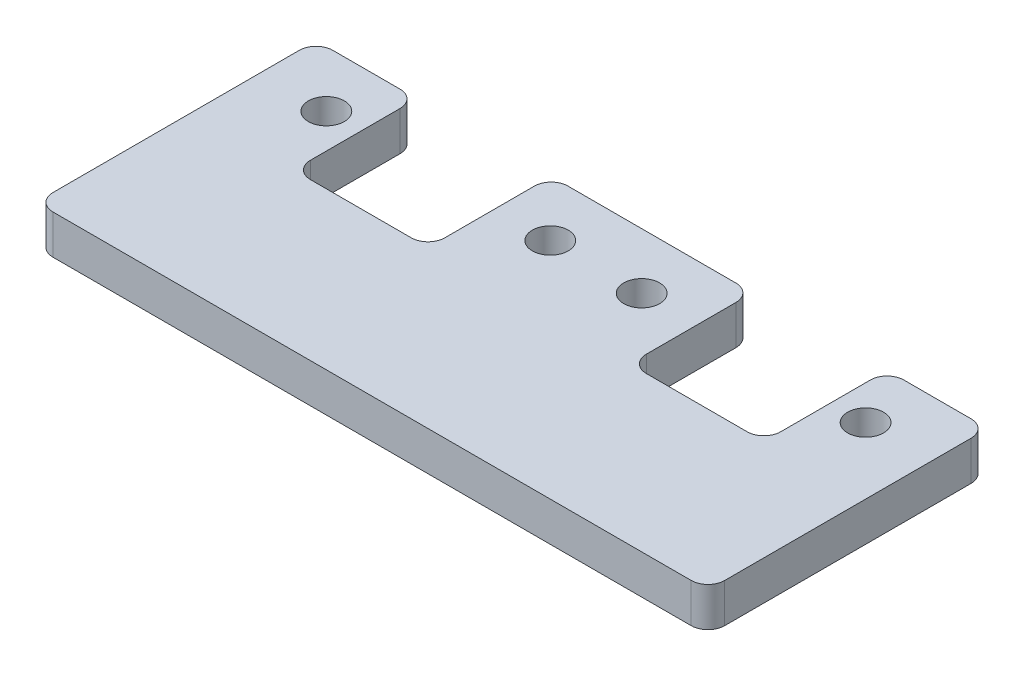
from build123d import *

# Parameters (mm, degrees)
BOSS_EXTRUDE1_DEPTH   = 3.5
F_2_CLEARANCE_HOLE1_D = 3.2131
FILLET1_R             = 1.5


with BuildPart() as part:
    # Sketch1 → Boss-Extrude1 (new body)
    with BuildSketch(Plane(origin=(0, 0, 0), x_dir=(1, 0, 0), z_dir=(0, 1, 0))):
        Polygon((-21, 12.5), (-21, 1.5), (-9, 1.5), (-9, 12.5), (9, 12.5), (9, 1.5), (21, 1.5), (21, 12.5), (30, 12.5), (30, -12.5), (-30, -12.5), (-30, 12.5), align=None)
    extrude(amount=BOSS_EXTRUDE1_DEPTH)

    # #2 Clearance Hole1 (through all)
    with Locations(Plane(origin=(0, 3.5, 0), x_dir=(1, 0, 0), z_dir=(0, 1, 0))):
        with Locations((24.079999968, 7.5), (-24.079999968, 7.5), (-4.079999968, 7.5), (4.079999968, 7.5)):
            Hole(F_2_CLEARANCE_HOLE1_D / 2)

    # Fillet1
    fillet1_edges = [part.edges().sort_by_distance(p)[0] for p in [
        (30, 1.75, -12.5),
        (30, 1.75, 12.5),
        (-30, 1.75, 12.5),
        (-30, 1.75, -12.5),
        (-21, 1.75, -12.5),
        (-21, 1.75, -1.5),
        (-9, 1.75, -1.5),
        (-9, 1.75, -12.5),
        (9, 1.75, -12.5),
        (9, 1.75, -1.5),
        (21, 1.75, -1.5),
        (21, 1.75, -12.5),
    ]]
    fillet(fillet1_edges, radius=FILLET1_R)


solid = part.part
